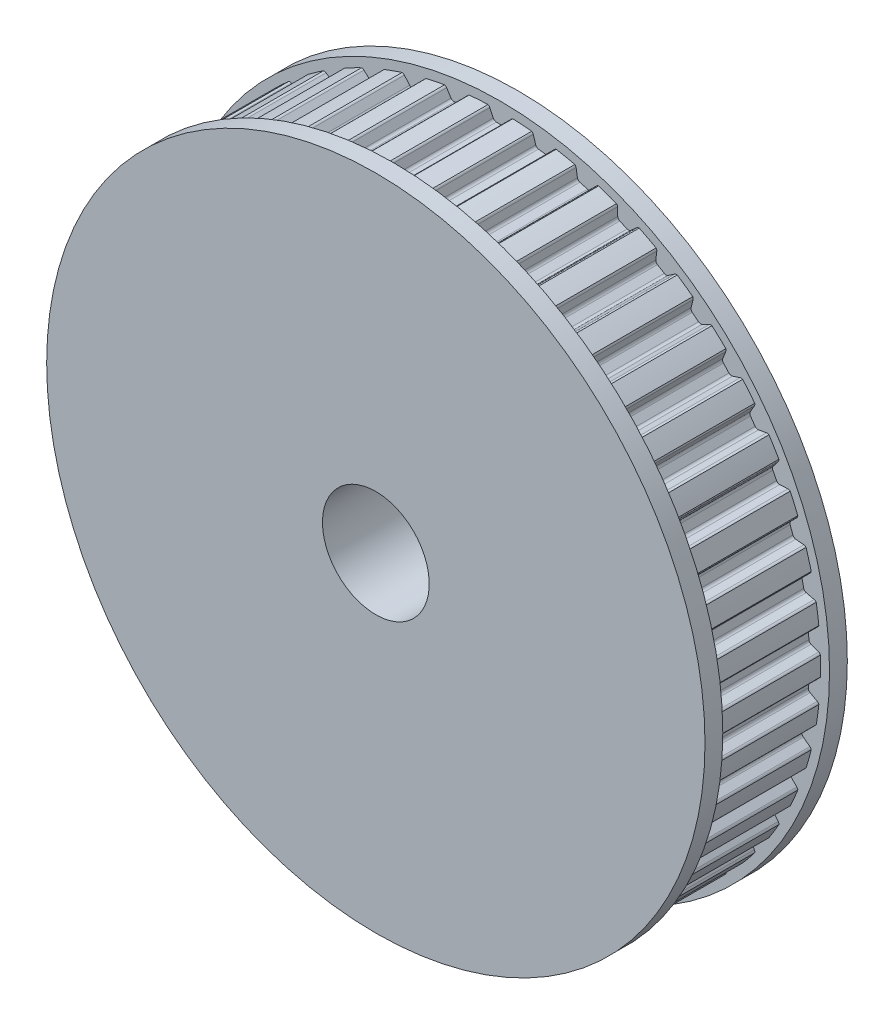
from build123d import *

# Parameters (mm, degrees)
SKETCH2_OUTSIDE_W  = 97.774
SKETCH2_OUTSIDE_H  = 97.774
CUT_EXTRUDE1_DEPTH = 12


with BuildPart() as part:
    # Sketch1 → Revolve1 (revolve)
    with BuildSketch(Plane(origin=(0, 0, 0), x_dir=(0, 0, -1), z_dir=(1, 0, 0)), mode=Mode.PRIVATE) as revolve1_sk:
        Polygon((15, 6), (-15, 6), (-15, 37), (-13, 37), (-13, 36), (-1, 36), (-1, 37), (1, 37), (1, 10), (15, 10), align=None)
    revolve(revolve1_sk.sketch.rotate(Axis((0, 0, -141.75257732), (0, 0, 1)), 90), axis=Axis((0, 0, -141.75257732), (0, 0, 1)))

    # Sketch2 outside → Cut-Extrude1 (cut)
    with BuildSketch(Plane.XY.offset(1)):
        Rectangle(SKETCH2_OUTSIDE_W, SKETCH2_OUTSIDE_H)
        with BuildLine():
            Line((0.452202575, 34.73), (-0.452202575, 34.73))
            ThreePointArc((-0.452202575, 34.73), (-0.656376426, 34.789511251), (-0.796599534, 34.949405061))
            Line((-0.796599534, 34.949405061), (-1.184219347, 35.780658432))
            ThreePointArc((-1.184219347, 35.780658432), (-1.321521664, 35.938672672), (-1.521670072, 36))
            Line((-1.521670072, 36), (-3.394502212, 35.871894772))
            ThreePointArc((-3.394502212, 35.871894772), (-3.584435691, 35.783885112), (-3.698942897, 35.608646629))
            Line((-3.698942897, 35.608646629), (-3.969763412, 34.732354705))
            ThreePointArc((-3.969763412, 34.732354705), (-4.08690827, 34.554856444), (-4.281076987, 34.468097815))
            Line((-4.281076987, 34.468097815), (-5.177058459, 34.344947996))
            ThreePointArc((-5.177058459, 34.344947996), (-5.387434071, 34.376103287), (-5.548123338, 34.515414127))
            Line((-5.548123338, 34.515414127), (-6.045321825, 35.286144268))
            ThreePointArc((-6.045321825, 35.286144268), (-6.202861571, 35.423990759), (-6.409496523, 35.457493343))
            Line((-6.409496523, 35.457493343), (-8.247441343, 35.075564017))
            ThreePointArc((-8.247441343, 35.075564017), (-8.42362179, 34.962511478), (-8.513200834, 34.773313113))
            Line((-8.513200834, 34.773313113), (-8.662177177, 33.868306298))
            ThreePointArc((-8.662177177, 33.868306298), (-8.754061598, 33.676510042), (-8.934608185, 33.564120184))
            Line((-8.934608185, 33.564120184), (-9.805475539, 33.320114595))
            ThreePointArc((-9.805475539, 33.320114595), (-10.018134013, 33.322333561), (-10.196296102, 33.438466333))
            Line((-10.196296102, 33.438466333), (-10.793811396, 34.134316001))
            ThreePointArc((-10.793811396, 34.134316001), (-10.968653903, 34.249426922), (-11.17792618, 34.254480672))
            Line((-11.17792618, 34.254480672), (-12.946746247, 33.625841869))
            ThreePointArc((-12.946746247, 33.625841869), (-13.105891754, 33.489852407), (-13.168873946, 33.290218567))
            Line((-13.168873946, 33.290218567), (-13.19323097, 32.373355425))
            ThreePointArc((-13.19323097, 32.373355425), (-13.258143321, 32.170833976), (-13.421704538, 32.0349065))
            Line((-13.421704538, 32.0349065), (-14.251235163, 31.674590503))
            ThreePointArc((-14.251235163, 31.674590503), (-14.462215074, 31.647831809), (-14.654531161, 31.73862318))
            Line((-14.654531161, 31.73862318), (-15.341232683, 32.346630011))
            ThreePointArc((-15.341232683, 32.346630011), (-15.530120966, 32.436861065), (-15.738132222, 32.413371839))
            Line((-15.738132222, 32.413371839), (-17.404877764, 31.549733911))
            ThreePointArc((-17.404877764, 31.549733911), (-17.544023752, 31.393340751), (-17.579235854, 31.186990238))
            Line((-17.579235854, 31.186990238), (-17.478519833, 30.275350194))
            ThreePointArc((-17.478519833, 30.275350194), (-17.51525092, 30.065876143), (-17.65877993, 29.90894312))
            Line((-17.65877993, 29.90894312), (-18.43152124, 29.43902872))
            ThreePointArc((-18.43152124, 29.43902872), (-18.636892431, 29.383790831), (-18.839780032, 29.447549529))
            Line((-18.839780032, 29.447549529), (-19.602875832, 29.956387506))
            ThreePointArc((-19.602875832, 29.956387506), (-19.802291259, 30.020057858), (-20.005166638, 29.968463217))
            Line((-20.005166638, 29.968463217), (-21.53878934, 28.885914103))
            ThreePointArc((-21.53878934, 28.885914103), (-21.655343782, 28.712030555), (-21.662129858, 28.502807288))
            Line((-21.662129858, 28.502807288), (-21.438216942, 27.613372471))
            ThreePointArc((-21.438216942, 27.613372471), (-21.446082534, 27.400847925), (-21.566905663, 27.22583272))
            Line((-21.566905663, 27.22583272), (-22.26846295, 26.655073533))
            ThreePointArc((-22.26846295, 26.655073533), (-22.464399744, 26.572385426), (-22.674079448, 26.607923746))
            Line((-22.674079448, 26.607923746), (-23.499354495, 27.008114181))
            ThreePointArc((-23.499354495, 27.008114181), (-23.705582334, 27.044037774), (-23.899542652, 26.965298827))
            Line((-23.899542652, 26.965298827), (-25.271474023, 25.684004371))
            ThreePointArc((-25.271474023, 25.684004371), (-25.363265731, 25.495869555), (-25.34149937, 25.287670967))
            Line((-25.34149937, 25.287670967), (-24.998560632, 24.437009866))
            ThreePointArc((-24.998560632, 24.437009866), (-24.977414209, 24.225393754), (-25.07328075, 24.035556569))
            Line((-25.07328075, 24.035556569), (-25.690585328, 23.374584759))
            ThreePointArc((-25.690585328, 23.374584759), (-25.873437794, 23.265986757), (-26.086003664, 23.272642689))
            Line((-26.086003664, 23.272642689), (-26.958084645, 23.556730791))
            ThreePointArc((-26.958084645, 23.556730791), (-27.167283263, 23.564238436), (-27.348715405, 23.459821941))
            Line((-27.348715405, 23.459821941), (-28.533398961, 22.003650232))
            ThreePointArc((-28.533398961, 22.003650232), (-28.598718029, 21.804768746), (-28.548804696, 21.601473183))
            Line((-28.548804696, 21.601473183), (-28.093228437, 20.805432004))
            ThreePointArc((-28.093228437, 20.805432004), (-28.043463915, 20.598666333), (-28.112588058, 20.397543476))
            Line((-28.112588058, 20.397543476), (-28.634140711, 19.658671698))
            ThreePointArc((-28.634140711, 19.658671698), (-28.800502653, 19.526186776), (-29.011994989, 19.503836332))
            Line((-29.011994989, 19.503836332), (-29.914636685, 19.666530077))
            ThreePointArc((-29.914636685, 19.666530077), (-30.122909107, 19.64548192), (-30.288433336, 19.51733296))
            Line((-30.288433336, 19.51733296), (-31.263800663, 17.913409723))
            ThreePointArc((-31.263800663, 17.913409723), (-31.30143032, 17.70748635), (-31.224299808, 17.512880825))
            Line((-31.224299808, 17.512880825), (-30.66457255, 16.786288309))
            ThreePointArc((-30.66457255, 16.786288309), (-30.58711695, 16.588224733), (-30.62821104, 16.379562742))
            Line((-30.62821104, 16.379562742), (-31.04429623, 15.576554778))
            ThreePointArc((-31.04429623, 15.576554778), (-31.19106864, 15.42265088), (-31.39754774, 15.371710407))
            Line((-31.39754774, 15.371710407), (-32.313935645, 15.409979118))
            ThreePointArc((-32.313935645, 15.409979118), (-32.517402149, 15.360767247), (-32.663935062, 15.211272994))
            Line((-32.663935062, 15.211272994), (-33.411816913, 13.489476284))
            ThreePointArc((-33.411816913, 13.489476284), (-33.421056189, 13.280346988), (-33.318145292, 13.098056633))
            Line((-33.318145292, 13.098056633), (-32.664693697, 12.454447824))
            ThreePointArc((-32.664693697, 12.454447824), (-32.560989868, 12.268775892), (-32.573288402, 12.056461746))
            Line((-32.573288402, 12.056461746), (-32.876155248, 11.204276115))
            ThreePointArc((-32.876155248, 11.204276115), (-33.000604034, 11.031820179), (-33.198223583, 10.953238601))
            Line((-33.198223583, 10.953238601), (-34.111287124, 10.866369405))
            ThreePointArc((-34.111287124, 10.866369405), (-34.306157514, 10.789910544), (-34.43096948, 10.621855793))
            Line((-34.43096948, 10.621855793), (-34.93743423, 8.814259424))
            ThreePointArc((-34.93743423, 8.814259424), (-34.918111017, 8.605819889), (-34.79133677, 8.439240428))
            Line((-34.79133677, 8.439240428), (-34.056333404, 7.89060454))
            ThreePointArc((-34.056333404, 7.89060454), (-33.928313153, 7.72078297), (-33.911587032, 7.508771679))
            Line((-33.911587032, 7.508771679), (-34.095593698, 6.623282988))
            ThreePointArc((-34.095593698, 6.623282988), (-34.195400614, 6.435487541), (-34.380479334, 6.330728684))
            Line((-34.380479334, 6.330728684), (-35.273209864, 6.12033979))
            ThreePointArc((-35.273209864, 6.12033979), (-35.455854075, 6.018058223), (-35.556620083, 5.834573515))
            Line((-35.556620083, 5.834573515), (-35.812233253, 3.974849589))
            ThreePointArc((-35.812233253, 3.974849589), (-35.764707503, 3.770982649), (-35.616431472, 3.623217142))
            Line((-35.616431472, 3.623217142), (-34.813568056, 3.179774224))
            ThreePointArc((-34.813568056, 3.179774224), (-34.663616159, 3.028966469), (-34.618176959, 2.821207403))
            Line((-34.618176959, 2.821207403), (-34.679895749, 1.91891063))
            ThreePointArc((-34.679895749, 1.91891063), (-34.753201582, 1.719273946), (-34.922291805, 1.59028927))
            Line((-34.922291805, 1.59028927), (-35.778059445, 1.260299825))
            ThreePointArc((-35.778059445, 1.260299825), (-35.945075159, 1.134100864), (-36.019918129, 0.938604173))
            Line((-36.019918129, 0.938604173), (-36.019918129, -0.938604173))
            ThreePointArc((-36.019918129, -0.938604173), (-35.945075159, -1.134100864), (-35.778059445, -1.260299825))
            Line((-35.778059445, -1.260299825), (-34.922291805, -1.59028927))
            ThreePointArc((-34.922291805, -1.59028927), (-34.753201582, -1.719273946), (-34.679895749, -1.91891063))
            Line((-34.679895749, -1.91891063), (-34.618176959, -2.821207403))
            ThreePointArc((-34.618176959, -2.821207403), (-34.663616159, -3.028966469), (-34.813568056, -3.179774224))
            Line((-34.813568056, -3.179774224), (-35.616431472, -3.623217142))
            ThreePointArc((-35.616431472, -3.623217142), (-35.764707503, -3.770982649), (-35.812233253, -3.974849589))
            Line((-35.812233253, -3.974849589), (-35.556620083, -5.834573515))
            ThreePointArc((-35.556620083, -5.834573515), (-35.455854075, -6.018058223), (-35.273209864, -6.12033979))
            Line((-35.273209864, -6.12033979), (-34.380479334, -6.330728684))
            ThreePointArc((-34.380479334, -6.330728684), (-34.195400614, -6.435487541), (-34.095593698, -6.623282988))
            Line((-34.095593698, -6.623282988), (-33.911587032, -7.508771679))
            ThreePointArc((-33.911587032, -7.508771679), (-33.928313153, -7.72078297), (-34.056333404, -7.89060454))
            Line((-34.056333404, -7.89060454), (-34.79133677, -8.439240428))
            ThreePointArc((-34.79133677, -8.439240428), (-34.918111017, -8.605819889), (-34.93743423, -8.814259424))
            Line((-34.93743423, -8.814259424), (-34.43096948, -10.621855793))
            ThreePointArc((-34.43096948, -10.621855793), (-34.306157514, -10.789910544), (-34.111287124, -10.866369405))
            Line((-34.111287124, -10.866369405), (-33.198223583, -10.953238601))
            ThreePointArc((-33.198223583, -10.953238601), (-33.000604034, -11.031820179), (-32.876155248, -11.204276115))
            Line((-32.876155248, -11.204276115), (-32.573288402, -12.056461746))
            ThreePointArc((-32.573288402, -12.056461746), (-32.560989868, -12.268775892), (-32.664693697, -12.454447824))
            Line((-32.664693697, -12.454447824), (-33.318145292, -13.098056633))
            ThreePointArc((-33.318145292, -13.098056633), (-33.421056189, -13.280346988), (-33.411816913, -13.489476284))
            Line((-33.411816913, -13.489476284), (-32.663935062, -15.211272994))
            ThreePointArc((-32.663935062, -15.211272994), (-32.517402149, -15.360767247), (-32.313935645, -15.409979118))
            Line((-32.313935645, -15.409979118), (-31.39754774, -15.371710407))
            ThreePointArc((-31.39754774, -15.371710407), (-31.19106864, -15.42265088), (-31.04429623, -15.576554778))
            Line((-31.04429623, -15.576554778), (-30.62821104, -16.379562743))
            ThreePointArc((-30.62821104, -16.379562743), (-30.58711695, -16.588224733), (-30.66457255, -16.786288309))
            Line((-30.66457255, -16.786288309), (-31.224299808, -17.512880825))
            ThreePointArc((-31.224299808, -17.512880825), (-31.30143032, -17.70748635), (-31.263800663, -17.913409723))
            Line((-31.263800663, -17.913409723), (-30.288433336, -19.51733296))
            ThreePointArc((-30.288433336, -19.51733296), (-30.122909107, -19.64548192), (-29.914636685, -19.666530077))
            Line((-29.914636685, -19.666530077), (-29.011994989, -19.503836332))
            ThreePointArc((-29.011994989, -19.503836332), (-28.800502653, -19.526186776), (-28.634140711, -19.658671698))
            Line((-28.634140711, -19.658671698), (-28.112588058, -20.397543476))
            ThreePointArc((-28.112588058, -20.397543476), (-28.043463915, -20.598666333), (-28.093228437, -20.805432004))
            Line((-28.093228437, -20.805432004), (-28.548804696, -21.601473183))
            ThreePointArc((-28.548804696, -21.601473183), (-28.598718029, -21.804768746), (-28.533398961, -22.003650232))
            Line((-28.533398961, -22.003650232), (-27.348715405, -23.459821941))
            ThreePointArc((-27.348715405, -23.459821941), (-27.167283263, -23.564238436), (-26.958084645, -23.556730791))
            Line((-26.958084645, -23.556730791), (-26.086003664, -23.272642689))
            ThreePointArc((-26.086003664, -23.272642689), (-25.873437794, -23.265986757), (-25.690585328, -23.374584759))
            Line((-25.690585328, -23.374584759), (-25.07328075, -24.035556569))
            ThreePointArc((-25.07328075, -24.035556569), (-24.977414209, -24.225393754), (-24.998560632, -24.437009866))
            Line((-24.998560632, -24.437009866), (-25.34149937, -25.287670967))
            ThreePointArc((-25.34149937, -25.287670967), (-25.363265731, -25.495869555), (-25.271474023, -25.684004371))
            Line((-25.271474023, -25.684004371), (-23.899542652, -26.965298827))
            ThreePointArc((-23.899542652, -26.965298827), (-23.705582334, -27.044037774), (-23.499354495, -27.008114181))
            Line((-23.499354495, -27.008114181), (-22.674079448, -26.607923746))
            ThreePointArc((-22.674079448, -26.607923746), (-22.464399744, -26.572385426), (-22.26846295, -26.655073533))
            Line((-22.26846295, -26.655073533), (-21.566905663, -27.22583272))
            ThreePointArc((-21.566905663, -27.22583272), (-21.446082534, -27.400847925), (-21.438216942, -27.613372471))
            Line((-21.438216942, -27.613372471), (-21.662129858, -28.502807288))
            ThreePointArc((-21.662129858, -28.502807288), (-21.655343782, -28.712030555), (-21.53878934, -28.885914103))
            Line((-21.53878934, -28.885914103), (-20.005166638, -29.968463217))
            ThreePointArc((-20.005166638, -29.968463217), (-19.802291259, -30.020057858), (-19.602875832, -29.956387506))
            Line((-19.602875832, -29.956387506), (-18.839780032, -29.447549529))
            ThreePointArc((-18.839780032, -29.447549529), (-18.636892431, -29.383790831), (-18.43152124, -29.43902872))
            Line((-18.43152124, -29.43902872), (-17.65877993, -29.90894312))
            ThreePointArc((-17.65877993, -29.90894312), (-17.51525092, -30.065876143), (-17.478519833, -30.275350194))
            Line((-17.478519833, -30.275350194), (-17.579235854, -31.186990238))
            ThreePointArc((-17.579235854, -31.186990238), (-17.544023752, -31.393340751), (-17.404877764, -31.549733911))
            Line((-17.404877764, -31.549733911), (-15.738132222, -32.413371839))
            ThreePointArc((-15.738132222, -32.413371839), (-15.530120966, -32.436861065), (-15.341232683, -32.346630011))
            Line((-15.341232683, -32.346630011), (-14.654531161, -31.73862318))
            ThreePointArc((-14.654531161, -31.73862318), (-14.462215074, -31.647831809), (-14.251235163, -31.674590503))
            Line((-14.251235163, -31.674590503), (-13.421704538, -32.0349065))
            ThreePointArc((-13.421704538, -32.0349065), (-13.258143321, -32.170833976), (-13.19323097, -32.373355425))
            Line((-13.19323097, -32.373355425), (-13.168873946, -33.290218567))
            ThreePointArc((-13.168873946, -33.290218567), (-13.105891754, -33.489852407), (-12.946746247, -33.625841869))
            Line((-12.946746247, -33.625841869), (-11.17792618, -34.254480672))
            ThreePointArc((-11.17792618, -34.254480672), (-10.968653903, -34.249426922), (-10.793811396, -34.134316001))
            Line((-10.793811396, -34.134316001), (-10.196296102, -33.438466333))
            ThreePointArc((-10.196296102, -33.438466333), (-10.018134013, -33.322333561), (-9.805475539, -33.320114595))
            Line((-9.805475539, -33.320114595), (-8.934608185, -33.564120184))
            ThreePointArc((-8.934608185, -33.564120184), (-8.754061598, -33.676510042), (-8.662177177, -33.868306298))
            Line((-8.662177177, -33.868306298), (-8.513200834, -34.773313113))
            ThreePointArc((-8.513200834, -34.773313113), (-8.42362179, -34.962511478), (-8.247441343, -35.075564017))
            Line((-8.247441343, -35.075564017), (-6.409496523, -35.457493343))
            ThreePointArc((-6.409496523, -35.457493343), (-6.202861571, -35.423990759), (-6.045321825, -35.286144268))
            Line((-6.045321825, -35.286144268), (-5.548123338, -34.515414127))
            ThreePointArc((-5.548123338, -34.515414127), (-5.387434071, -34.376103287), (-5.177058459, -34.344947996))
            Line((-5.177058459, -34.344947996), (-4.281076987, -34.468097815))
            ThreePointArc((-4.281076987, -34.468097815), (-4.08690827, -34.554856444), (-3.969763412, -34.732354705))
            Line((-3.969763412, -34.732354705), (-3.698942897, -35.608646629))
            ThreePointArc((-3.698942897, -35.608646629), (-3.58443569, -35.783885112), (-3.394502212, -35.871894772))
            Line((-3.394502212, -35.871894772), (-1.521670072, -36))
            ThreePointArc((-1.521670072, -36), (-1.321521664, -35.938672672), (-1.184219347, -35.780658432))
            Line((-1.184219347, -35.780658432), (-0.796599534, -34.949405061))
            ThreePointArc((-0.796599534, -34.949405061), (-0.656376426, -34.789511251), (-0.452202575, -34.73))
            Line((-0.452202575, -34.73), (0.452202575, -34.73))
            ThreePointArc((0.452202575, -34.73), (0.656376426, -34.789511251), (0.796599534, -34.949405061))
            Line((0.796599534, -34.949405061), (1.184219347, -35.780658432))
            ThreePointArc((1.184219347, -35.780658432), (1.321521664, -35.938672672), (1.521670072, -36))
            Line((1.521670072, -36), (3.394502212, -35.871894772))
            ThreePointArc((3.394502212, -35.871894772), (3.584435691, -35.783885112), (3.698942897, -35.608646629))
            Line((3.698942897, -35.608646629), (3.969763412, -34.732354705))
            ThreePointArc((3.969763412, -34.732354705), (4.08690827, -34.554856444), (4.281076987, -34.468097815))
            Line((4.281076987, -34.468097815), (5.177058459, -34.344947996))
            ThreePointArc((5.177058459, -34.344947996), (5.387434071, -34.376103287), (5.548123338, -34.515414127))
            Line((5.548123338, -34.515414127), (6.045321825, -35.286144268))
            ThreePointArc((6.045321825, -35.286144268), (6.202861571, -35.423990759), (6.409496523, -35.457493343))
            Line((6.409496523, -35.457493343), (8.247441343, -35.075564017))
            ThreePointArc((8.247441343, -35.075564017), (8.42362179, -34.962511478), (8.513200834, -34.773313113))
            Line((8.513200834, -34.773313113), (8.662177177, -33.868306298))
            ThreePointArc((8.662177177, -33.868306298), (8.754061598, -33.676510042), (8.934608185, -33.564120184))
            Line((8.934608185, -33.564120184), (9.805475539, -33.320114595))
            ThreePointArc((9.805475539, -33.320114595), (10.018134013, -33.322333561), (10.196296102, -33.438466333))
            Line((10.196296102, -33.438466333), (10.793811396, -34.134316001))
            ThreePointArc((10.793811396, -34.134316001), (10.968653903, -34.249426922), (11.17792618, -34.254480672))
            Line((11.17792618, -34.254480672), (12.946746247, -33.625841869))
            ThreePointArc((12.946746247, -33.625841869), (13.105891754, -33.489852407), (13.168873946, -33.290218567))
            Line((13.168873946, -33.290218567), (13.19323097, -32.373355425))
            ThreePointArc((13.19323097, -32.373355425), (13.258143321, -32.170833976), (13.421704538, -32.0349065))
            Line((13.421704538, -32.0349065), (14.251235163, -31.674590503))
            ThreePointArc((14.251235163, -31.674590503), (14.462215074, -31.647831809), (14.654531161, -31.73862318))
            Line((14.654531161, -31.73862318), (15.341232683, -32.346630011))
            ThreePointArc((15.341232683, -32.346630011), (15.530120966, -32.436861065), (15.738132222, -32.413371839))
            Line((15.738132222, -32.413371839), (17.404877764, -31.549733911))
            ThreePointArc((17.404877764, -31.549733911), (17.544023752, -31.393340751), (17.579235854, -31.186990238))
            Line((17.579235854, -31.186990238), (17.478519833, -30.275350194))
            ThreePointArc((17.478519833, -30.275350194), (17.51525092, -30.065876143), (17.65877993, -29.90894312))
            Line((17.65877993, -29.90894312), (18.43152124, -29.43902872))
            ThreePointArc((18.43152124, -29.43902872), (18.636892431, -29.383790831), (18.839780032, -29.447549529))
            Line((18.839780032, -29.447549529), (19.602875832, -29.956387506))
            ThreePointArc((19.602875832, -29.956387506), (19.802291259, -30.020057858), (20.005166638, -29.968463217))
            Line((20.005166638, -29.968463217), (21.53878934, -28.885914103))
            ThreePointArc((21.53878934, -28.885914103), (21.655343782, -28.712030555), (21.662129858, -28.502807288))
            Line((21.662129858, -28.502807288), (21.438216942, -27.613372471))
            ThreePointArc((21.438216942, -27.613372471), (21.446082534, -27.400847925), (21.566905663, -27.22583272))
            Line((21.566905663, -27.22583272), (22.26846295, -26.655073533))
            ThreePointArc((22.26846295, -26.655073533), (22.464399744, -26.572385426), (22.674079448, -26.607923746))
            Line((22.674079448, -26.607923746), (23.499354495, -27.008114181))
            ThreePointArc((23.499354495, -27.008114181), (23.705582334, -27.044037774), (23.899542652, -26.965298827))
            Line((23.899542652, -26.965298827), (25.271474023, -25.684004371))
            ThreePointArc((25.271474023, -25.684004371), (25.363265731, -25.495869555), (25.34149937, -25.287670967))
            Line((25.34149937, -25.287670967), (24.998560632, -24.437009866))
            ThreePointArc((24.998560632, -24.437009866), (24.977414209, -24.225393754), (25.07328075, -24.035556569))
            Line((25.07328075, -24.035556569), (25.690585328, -23.374584759))
            ThreePointArc((25.690585328, -23.374584759), (25.873437794, -23.265986757), (26.086003664, -23.272642689))
            Line((26.086003664, -23.272642689), (26.958084645, -23.556730791))
            ThreePointArc((26.958084645, -23.556730791), (27.167283263, -23.564238436), (27.348715405, -23.459821941))
            Line((27.348715405, -23.459821941), (28.533398961, -22.003650232))
            ThreePointArc((28.533398961, -22.003650232), (28.598718029, -21.804768746), (28.548804696, -21.601473183))
            Line((28.548804696, -21.601473183), (28.093228437, -20.805432004))
            ThreePointArc((28.093228437, -20.805432004), (28.043463915, -20.598666333), (28.112588058, -20.397543476))
            Line((28.112588058, -20.397543476), (28.634140711, -19.658671698))
            ThreePointArc((28.634140711, -19.658671698), (28.800502653, -19.526186776), (29.011994989, -19.503836332))
            Line((29.011994989, -19.503836332), (29.914636685, -19.666530077))
            ThreePointArc((29.914636685, -19.666530077), (30.122909107, -19.64548192), (30.288433336, -19.51733296))
            Line((30.288433336, -19.51733296), (31.263800663, -17.913409723))
            ThreePointArc((31.263800663, -17.913409723), (31.30143032, -17.70748635), (31.224299808, -17.512880825))
            Line((31.224299808, -17.512880825), (30.664572551, -16.786288309))
            ThreePointArc((30.664572551, -16.786288309), (30.58711695, -16.588224733), (30.62821104, -16.379562742))
            Line((30.62821104, -16.379562742), (31.04429623, -15.576554778))
            ThreePointArc((31.04429623, -15.576554778), (31.19106864, -15.42265088), (31.39754774, -15.371710407))
            Line((31.39754774, -15.371710407), (32.313935645, -15.409979118))
            ThreePointArc((32.313935645, -15.409979118), (32.517402149, -15.360767247), (32.663935062, -15.211272994))
            Line((32.663935062, -15.211272994), (33.411816913, -13.489476284))
            ThreePointArc((33.411816913, -13.489476284), (33.421056189, -13.280346988), (33.318145292, -13.098056633))
            Line((33.318145292, -13.098056633), (32.664693697, -12.454447824))
            ThreePointArc((32.664693697, -12.454447824), (32.560989868, -12.268775892), (32.573288402, -12.056461746))
            Line((32.573288402, -12.056461746), (32.876155248, -11.204276115))
            ThreePointArc((32.876155248, -11.204276115), (33.000604034, -11.031820179), (33.198223583, -10.953238601))
            Line((33.198223583, -10.953238601), (34.111287124, -10.866369405))
            ThreePointArc((34.111287124, -10.866369405), (34.306157514, -10.789910544), (34.43096948, -10.621855793))
            Line((34.43096948, -10.621855793), (34.93743423, -8.814259424))
            ThreePointArc((34.93743423, -8.814259424), (34.918111017, -8.605819889), (34.79133677, -8.439240428))
            Line((34.79133677, -8.439240428), (34.056333404, -7.89060454))
            ThreePointArc((34.056333404, -7.89060454), (33.928313153, -7.72078297), (33.911587032, -7.508771679))
            Line((33.911587032, -7.508771679), (34.095593698, -6.623282988))
            ThreePointArc((34.095593698, -6.623282988), (34.195400614, -6.435487541), (34.380479334, -6.330728684))
            Line((34.380479334, -6.330728684), (35.273209864, -6.12033979))
            ThreePointArc((35.273209864, -6.12033979), (35.455854075, -6.018058223), (35.556620083, -5.834573515))
            Line((35.556620083, -5.834573515), (35.812233253, -3.974849589))
            ThreePointArc((35.812233253, -3.974849589), (35.764707503, -3.770982649), (35.616431472, -3.623217142))
            Line((35.616431472, -3.623217142), (34.813568056, -3.179774224))
            ThreePointArc((34.813568056, -3.179774224), (34.663616159, -3.028966469), (34.618176959, -2.821207403))
            Line((34.618176959, -2.821207403), (34.679895749, -1.91891063))
            ThreePointArc((34.679895749, -1.91891063), (34.753201582, -1.719273946), (34.922291805, -1.59028927))
            Line((34.922291805, -1.59028927), (35.778059445, -1.260299825))
            ThreePointArc((35.778059445, -1.260299825), (35.945075159, -1.134100864), (36.019918129, -0.938604173))
            Line((36.019918129, -0.938604173), (36.019918129, 0.938604173))
            ThreePointArc((36.019918129, 0.938604173), (35.945075159, 1.134100864), (35.778059445, 1.260299825))
            Line((35.778059445, 1.260299825), (34.922291805, 1.59028927))
            ThreePointArc((34.922291805, 1.59028927), (34.753201582, 1.719273946), (34.679895749, 1.91891063))
            Line((34.679895749, 1.91891063), (34.618176959, 2.821207403))
            ThreePointArc((34.618176959, 2.821207403), (34.663616159, 3.028966469), (34.813568056, 3.179774224))
            Line((34.813568056, 3.179774224), (35.616431472, 3.623217142))
            ThreePointArc((35.616431472, 3.623217142), (35.764707503, 3.770982649), (35.812233253, 3.974849589))
            Line((35.812233253, 3.974849589), (35.556620083, 5.834573515))
            ThreePointArc((35.556620083, 5.834573515), (35.455854075, 6.018058223), (35.273209864, 6.12033979))
            Line((35.273209864, 6.12033979), (34.380479334, 6.330728684))
            ThreePointArc((34.380479334, 6.330728684), (34.195400614, 6.435487541), (34.095593698, 6.623282988))
            Line((34.095593698, 6.623282988), (33.911587032, 7.508771679))
            ThreePointArc((33.911587032, 7.508771679), (33.928313153, 7.72078297), (34.056333404, 7.89060454))
            Line((34.056333404, 7.89060454), (34.79133677, 8.439240428))
            ThreePointArc((34.79133677, 8.439240428), (34.918111017, 8.605819889), (34.93743423, 8.814259424))
            Line((34.93743423, 8.814259424), (34.43096948, 10.621855793))
            ThreePointArc((34.43096948, 10.621855793), (34.306157514, 10.789910544), (34.111287124, 10.866369405))
            Line((34.111287124, 10.866369405), (33.198223583, 10.953238601))
            ThreePointArc((33.198223583, 10.953238601), (33.000604034, 11.031820179), (32.876155248, 11.204276115))
            Line((32.876155248, 11.204276115), (32.573288402, 12.056461746))
            ThreePointArc((32.573288402, 12.056461746), (32.560989868, 12.268775892), (32.664693697, 12.454447824))
            Line((32.664693697, 12.454447824), (33.318145292, 13.098056633))
            ThreePointArc((33.318145292, 13.098056633), (33.421056189, 13.280346988), (33.411816913, 13.489476284))
            Line((33.411816913, 13.489476284), (32.663935062, 15.211272994))
            ThreePointArc((32.663935062, 15.211272994), (32.517402149, 15.360767247), (32.313935645, 15.409979118))
            Line((32.313935645, 15.409979118), (31.39754774, 15.371710407))
            ThreePointArc((31.39754774, 15.371710407), (31.19106864, 15.42265088), (31.04429623, 15.576554778))
            Line((31.04429623, 15.576554778), (30.62821104, 16.379562743))
            ThreePointArc((30.62821104, 16.379562743), (30.58711695, 16.588224733), (30.66457255, 16.786288309))
            Line((30.66457255, 16.786288309), (31.224299808, 17.512880825))
            ThreePointArc((31.224299808, 17.512880825), (31.30143032, 17.70748635), (31.263800663, 17.913409723))
            Line((31.263800663, 17.913409723), (30.288433336, 19.51733296))
            ThreePointArc((30.288433336, 19.51733296), (30.122909107, 19.64548192), (29.914636685, 19.666530077))
            Line((29.914636685, 19.666530077), (29.011994989, 19.503836332))
            ThreePointArc((29.011994989, 19.503836332), (28.800502653, 19.526186776), (28.634140711, 19.658671698))
            Line((28.634140711, 19.658671698), (28.112588058, 20.397543476))
            ThreePointArc((28.112588058, 20.397543476), (28.043463915, 20.598666333), (28.093228437, 20.805432004))
            Line((28.093228437, 20.805432004), (28.548804696, 21.601473183))
            ThreePointArc((28.548804696, 21.601473183), (28.598718029, 21.804768746), (28.533398961, 22.003650232))
            Line((28.533398961, 22.003650232), (27.348715405, 23.459821941))
            ThreePointArc((27.348715405, 23.459821941), (27.167283263, 23.564238436), (26.958084645, 23.556730791))
            Line((26.958084645, 23.556730791), (26.086003664, 23.272642689))
            ThreePointArc((26.086003664, 23.272642689), (25.873437794, 23.265986757), (25.690585328, 23.374584759))
            Line((25.690585328, 23.374584759), (25.07328075, 24.035556569))
            ThreePointArc((25.07328075, 24.035556569), (24.977414209, 24.225393754), (24.998560632, 24.437009866))
            Line((24.998560632, 24.437009866), (25.34149937, 25.287670967))
            ThreePointArc((25.34149937, 25.287670967), (25.363265731, 25.495869555), (25.271474023, 25.684004371))
            Line((25.271474023, 25.684004371), (23.899542652, 26.965298827))
            ThreePointArc((23.899542652, 26.965298827), (23.705582334, 27.044037774), (23.499354495, 27.008114181))
            Line((23.499354495, 27.008114181), (22.674079448, 26.607923746))
            ThreePointArc((22.674079448, 26.607923746), (22.464399744, 26.572385426), (22.26846295, 26.655073533))
            Line((22.26846295, 26.655073533), (21.566905663, 27.22583272))
            ThreePointArc((21.566905663, 27.22583272), (21.446082534, 27.400847925), (21.438216942, 27.613372471))
            Line((21.438216942, 27.613372471), (21.662129858, 28.502807288))
            ThreePointArc((21.662129858, 28.502807288), (21.655343782, 28.712030555), (21.53878934, 28.885914103))
            Line((21.53878934, 28.885914103), (20.005166638, 29.968463217))
            ThreePointArc((20.005166638, 29.968463217), (19.802291259, 30.020057858), (19.602875832, 29.956387506))
            Line((19.602875832, 29.956387506), (18.839780032, 29.447549529))
            ThreePointArc((18.839780032, 29.447549529), (18.636892431, 29.383790831), (18.43152124, 29.43902872))
            Line((18.43152124, 29.43902872), (17.65877993, 29.90894312))
            ThreePointArc((17.65877993, 29.90894312), (17.51525092, 30.065876143), (17.478519833, 30.275350194))
            Line((17.478519833, 30.275350194), (17.579235854, 31.186990238))
            ThreePointArc((17.579235854, 31.186990238), (17.544023752, 31.393340751), (17.404877764, 31.549733911))
            Line((17.404877764, 31.549733911), (15.738132222, 32.413371839))
            ThreePointArc((15.738132222, 32.413371839), (15.530120966, 32.436861065), (15.341232683, 32.346630011))
            Line((15.341232683, 32.346630011), (14.654531161, 31.73862318))
            ThreePointArc((14.654531161, 31.73862318), (14.462215074, 31.647831809), (14.251235163, 31.674590503))
            Line((14.251235163, 31.674590503), (13.421704538, 32.0349065))
            ThreePointArc((13.421704538, 32.0349065), (13.258143321, 32.170833976), (13.19323097, 32.373355425))
            Line((13.19323097, 32.373355425), (13.168873946, 33.290218567))
            ThreePointArc((13.168873946, 33.290218567), (13.105891754, 33.489852407), (12.946746247, 33.625841869))
            Line((12.946746247, 33.625841869), (11.17792618, 34.254480672))
            ThreePointArc((11.17792618, 34.254480672), (10.968653903, 34.249426922), (10.793811396, 34.134316001))
            Line((10.793811396, 34.134316001), (10.196296102, 33.438466333))
            ThreePointArc((10.196296102, 33.438466333), (10.018134013, 33.322333561), (9.805475539, 33.320114595))
            Line((9.805475539, 33.320114595), (8.934608185, 33.564120184))
            ThreePointArc((8.934608185, 33.564120184), (8.754061598, 33.676510042), (8.662177177, 33.868306298))
            Line((8.662177177, 33.868306298), (8.513200834, 34.773313113))
            ThreePointArc((8.513200834, 34.773313113), (8.42362179, 34.962511478), (8.247441343, 35.075564017))
            Line((8.247441343, 35.075564017), (6.409496523, 35.457493343))
            ThreePointArc((6.409496523, 35.457493343), (6.202861571, 35.423990759), (6.045321825, 35.286144268))
            Line((6.045321825, 35.286144268), (5.548123338, 34.515414127))
            ThreePointArc((5.548123338, 34.515414127), (5.387434071, 34.376103287), (5.177058459, 34.344947996))
            Line((5.177058459, 34.344947996), (4.281076987, 34.468097815))
            ThreePointArc((4.281076987, 34.468097815), (4.08690827, 34.554856444), (3.969763412, 34.732354705))
            Line((3.969763412, 34.732354705), (3.698942897, 35.608646629))
            ThreePointArc((3.698942897, 35.608646629), (3.584435691, 35.783885112), (3.394502212, 35.871894772))
            Line((3.394502212, 35.871894772), (1.521670072, 36))
            ThreePointArc((1.521670072, 36), (1.321521664, 35.938672672), (1.184219347, 35.780658432))
            Line((1.184219347, 35.780658432), (0.796599534, 34.949405061))
            ThreePointArc((0.796599534, 34.949405061), (0.656376426, 34.789511251), (0.452202575, 34.73))
        make_face(mode=Mode.SUBTRACT)
    extrude(amount=CUT_EXTRUDE1_DEPTH, mode=Mode.SUBTRACT)


solid = part.part
